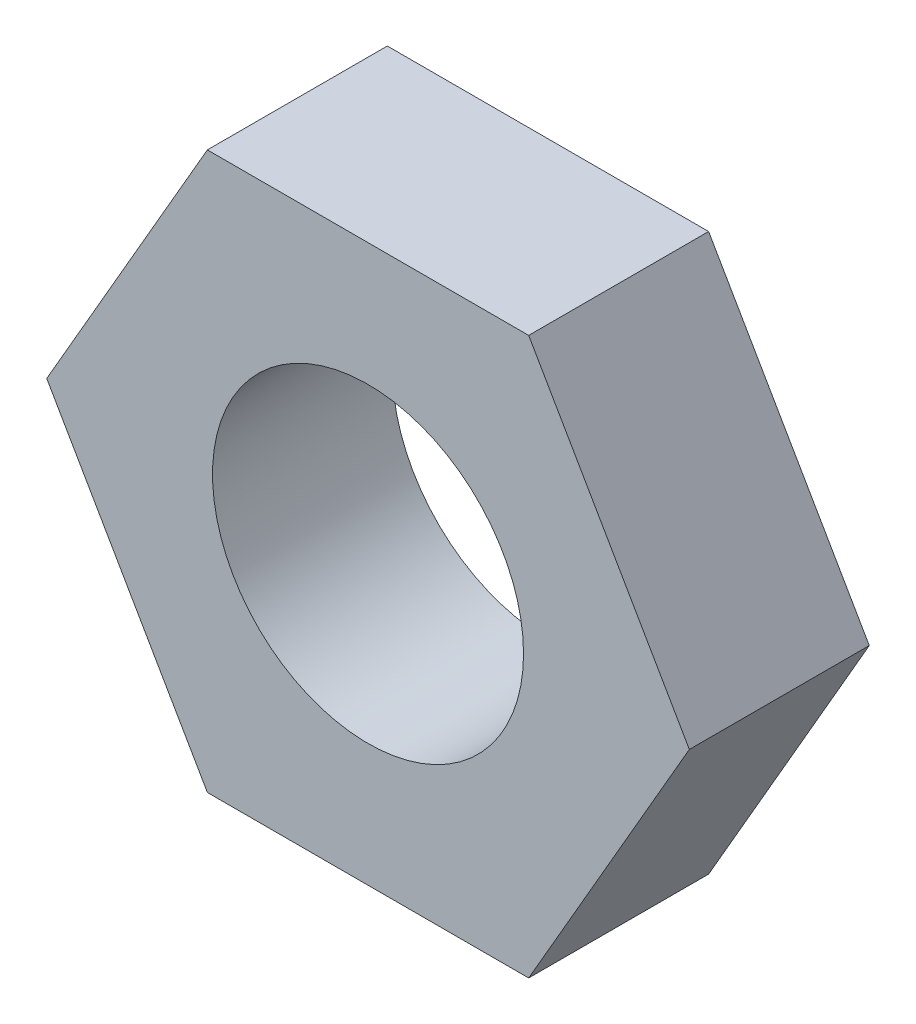
from build123d import *

# Parameters (mm, degrees)
SKETCH2_R           = 6.05
BOSS_EXTRUDE1_DEPTH = 7


with BuildPart() as part:
    # Sketch2 → Boss-Extrude1 (new body)
    with BuildSketch(Plane.XY):
        Polygon((12.5, 0), (6.25, 10.825317547), (-6.25, 10.825317547), (-12.5, 0), (-6.25, -10.825317547), (6.25, -10.825317547), align=None)
        Circle(SKETCH2_R, mode=Mode.SUBTRACT)
    extrude(amount=BOSS_EXTRUDE1_DEPTH)


solid = part.part
